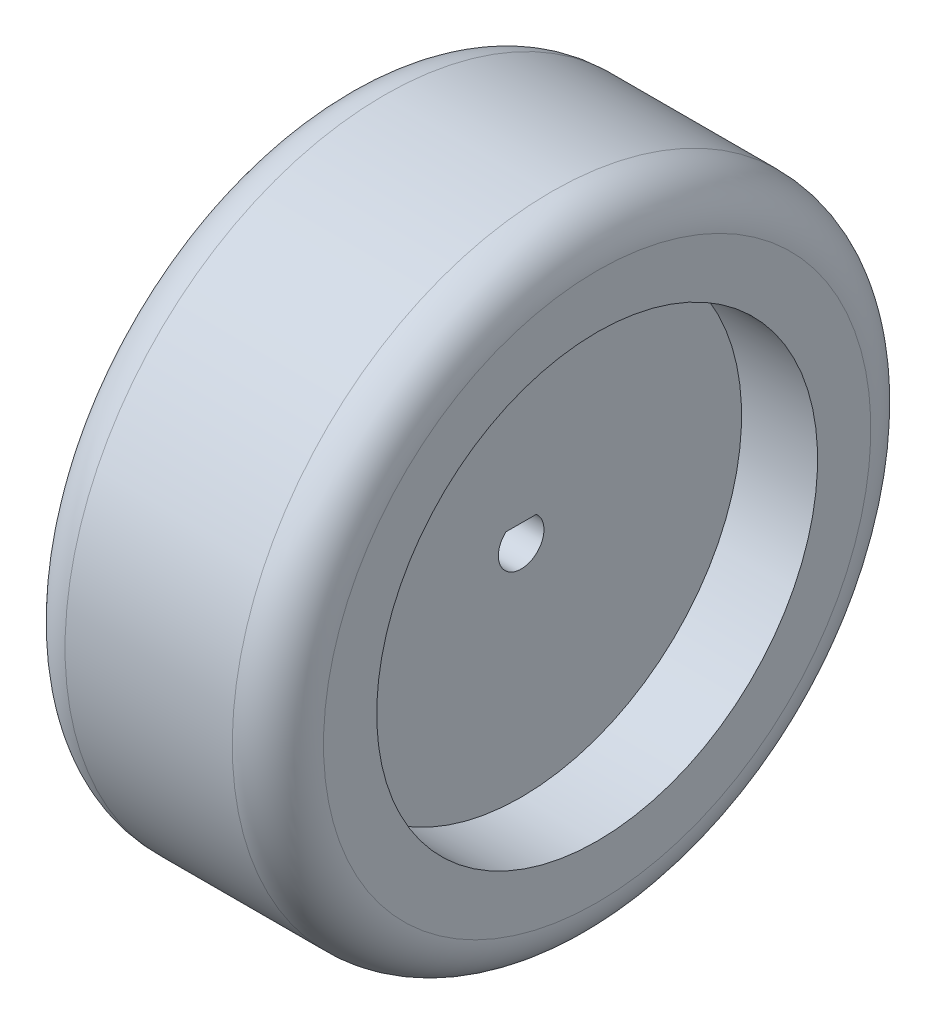
from build123d import *

# Parameters (mm, degrees)
CONG_1_R                = 3
ENL_V_MAT_EXTRU_1_REACH = 34.031


with BuildPart() as part:
    # Esquisse1 → Révolution1 (revolve)
    with BuildSketch(Plane.XY):
        Polygon((-17, 21), (0, 21), (0, 14.5), (-5, 14.5), (-5, 0), (-9, 0), (-9, 14.5), (-17, 14.5), align=None)
    revolve(axis=Axis((-5, 0, 0), (-1, 0, 0)))

    # Congé1
    cong_1_edges = [part.edges().sort_by_distance(p)[0] for p in [
        (-17, -21, 0),
        (0, -21, 0),
    ]]
    fillet(cong_1_edges, radius=CONG_1_R)

    # Esquisse2 → Enlèv. mat.-Extru.1 (cut, up to next)
    with BuildSketch(Plane(origin=(-5, 0, 0), x_dir=(0, 0, -1), z_dir=(1, 0, 0)), mode=Mode.PRIVATE) as enl_v_mat_extru_1_sk1:
        with BuildLine():
            Line((-1, 1.118033989), (1, 1.118033989))
            ThreePointArc((1, 1.118033989), (0, -1.5), (-1, 1.118033989))
        make_face()
    enl_v_mat_extru_1_tool1 = extrude(enl_v_mat_extru_1_sk1.sketch, amount=-ENL_V_MAT_EXTRU_1_REACH, mode=Mode.PRIVATE) & part.part
    add(enl_v_mat_extru_1_tool1.solids().sort_by_distance((-5, -0.101863, 0))[0], mode=Mode.SUBTRACT)


solid = part.part
